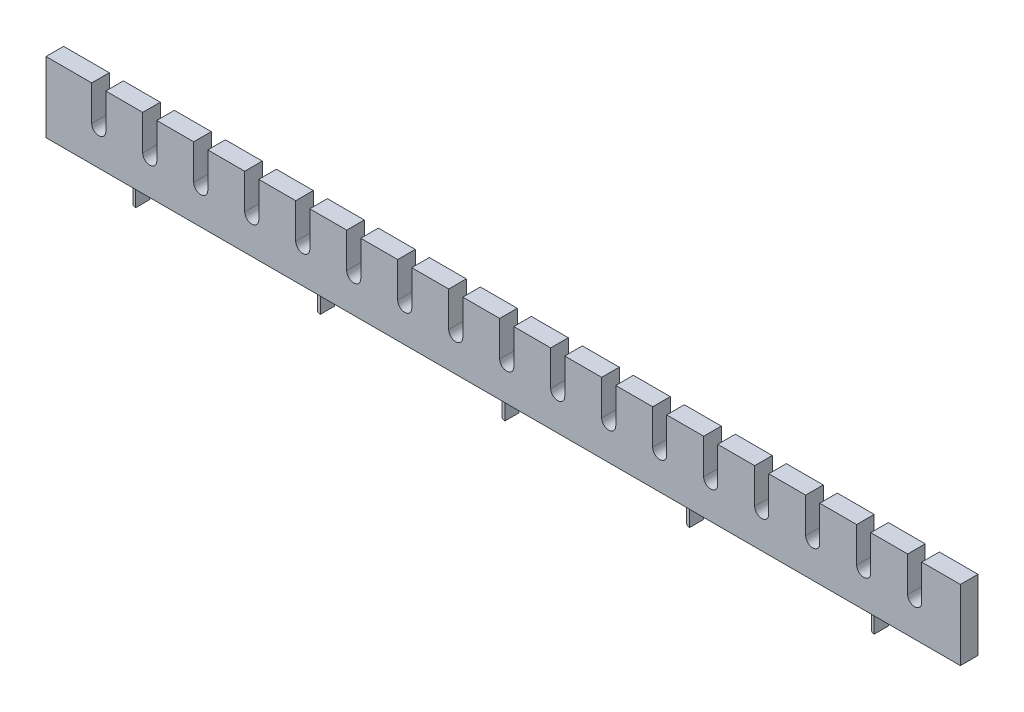
from build123d import *

# Parameters (mm, degrees)
SKETCH1_W           = 330.2
SKETCH1_H           = 6.35
BOSS_EXTRUDE1_DEPTH = 25.4
BOSS_EXTRUDE2_DEPTH = 6.35
CUT_EXTRUDE1_DEPTH  = 168.16307158


with BuildPart() as part:
    # Sketch1 → Boss-Extrude1 (new body)
    with BuildSketch(Plane(origin=(0, 0, 0), x_dir=(1, 0, 0), z_dir=(0, 1, 0))):
        Rectangle(SKETCH1_W, SKETCH1_H)
    extrude(amount=BOSS_EXTRUDE1_DEPTH)

    # Sketch2 → Boss-Extrude2 (add)
    with BuildSketch(Plane.XZ):
        with BuildLine():
            Line((-133.35, 2.54), (-133.35, -2.54))
            ThreePointArc((-133.35, -2.54), (-135.89, 0), (-133.35, 2.54))
        make_face()
        with BuildLine():
            Line((-66.675, 2.54), (-66.675, -2.54))
            ThreePointArc((-66.675, -2.54), (-69.215, 0), (-66.675, 2.54))
        make_face()
        with BuildLine():
            Line((0, 2.54), (0, -2.54))
            ThreePointArc((0, -2.54), (-2.54, 0), (0, 2.54))
        make_face()
        with BuildLine():
            Line((66.675, 2.54), (66.675, -2.54))
            ThreePointArc((66.675, -2.54), (64.135, 0), (66.675, 2.54))
        make_face()
        with BuildLine():
            Line((133.35, 2.54), (133.35, -2.54))
            ThreePointArc((133.35, -2.54), (130.81, 0), (133.35, 2.54))
        make_face()
    extrude(amount=BOSS_EXTRUDE2_DEPTH)

    # Sketch3 → Cut-Extrude1 (cut, through all)
    with BuildSketch(Plane.XY.offset(3.175)):
        with BuildLine():
            Line((-143.51, 38.1), (-143.51, 12.7))
            ThreePointArc((-143.51, 12.7), (-146.05, 10.16), (-148.59, 12.7))
            Line((-148.59, 12.7), (-148.59, 38.1))
            ThreePointArc((-148.59, 38.1), (-146.05, 40.64), (-143.51, 38.1))
        make_face()
        with BuildLine():
            Line((-125.095, 38.1), (-125.095, 12.7))
            ThreePointArc((-125.095, 12.7), (-127.635, 10.16), (-130.175, 12.7))
            Line((-130.175, 12.7), (-130.175, 38.1))
            ThreePointArc((-130.175, 38.1), (-127.635, 40.64), (-125.095, 38.1))
        make_face()
        with BuildLine():
            Line((-106.68, 38.1), (-106.68, 12.7))
            ThreePointArc((-106.68, 12.7), (-109.22, 10.16), (-111.76, 12.7))
            Line((-111.76, 12.7), (-111.76, 38.1))
            ThreePointArc((-111.76, 38.1), (-109.22, 40.64), (-106.68, 38.1))
        make_face()
        with BuildLine():
            Line((-88.265, 38.1), (-88.265, 12.7))
            ThreePointArc((-88.265, 12.7), (-90.805, 10.16), (-93.345, 12.7))
            Line((-93.345, 12.7), (-93.345, 38.1))
            ThreePointArc((-93.345, 38.1), (-90.805, 40.64), (-88.265, 38.1))
        make_face()
        with BuildLine():
            Line((-69.85, 38.1), (-69.85, 12.7))
            ThreePointArc((-69.85, 12.7), (-72.39, 10.16), (-74.93, 12.7))
            Line((-74.93, 12.7), (-74.93, 38.1))
            ThreePointArc((-74.93, 38.1), (-72.39, 40.64), (-69.85, 38.1))
        make_face()
        with BuildLine():
            Line((-51.435, 38.1), (-51.435, 12.7))
            ThreePointArc((-51.435, 12.7), (-53.975, 10.16), (-56.515, 12.7))
            Line((-56.515, 12.7), (-56.515, 38.1))
            ThreePointArc((-56.515, 38.1), (-53.975, 40.64), (-51.435, 38.1))
        make_face()
        with BuildLine():
            Line((-33.02, 38.1), (-33.02, 12.7))
            ThreePointArc((-33.02, 12.7), (-35.56, 10.16), (-38.1, 12.7))
            Line((-38.1, 12.7), (-38.1, 38.1))
            ThreePointArc((-38.1, 38.1), (-35.56, 40.64), (-33.02, 38.1))
        make_face()
        with BuildLine():
            Line((-14.605, 38.1), (-14.605, 12.7))
            ThreePointArc((-14.605, 12.7), (-17.145, 10.16), (-19.685, 12.7))
            Line((-19.685, 12.7), (-19.685, 38.1))
            ThreePointArc((-19.685, 38.1), (-17.145, 40.64), (-14.605, 38.1))
        make_face()
        with BuildLine():
            Line((3.81, 38.1), (3.81, 12.7))
            ThreePointArc((3.81, 12.7), (1.27, 10.16), (-1.27, 12.7))
            Line((-1.27, 12.7), (-1.27, 38.1))
            ThreePointArc((-1.27, 38.1), (1.27, 40.64), (3.81, 38.1))
        make_face()
        with BuildLine():
            Line((22.225, 38.1), (22.225, 12.7))
            ThreePointArc((22.225, 12.7), (19.685, 10.16), (17.145, 12.7))
            Line((17.145, 12.7), (17.145, 38.1))
            ThreePointArc((17.145, 38.1), (19.685, 40.64), (22.225, 38.1))
        make_face()
        with BuildLine():
            Line((40.64, 38.1), (40.64, 12.7))
            ThreePointArc((40.64, 12.7), (38.1, 10.16), (35.56, 12.7))
            Line((35.56, 12.7), (35.56, 38.1))
            ThreePointArc((35.56, 38.1), (38.1, 40.64), (40.64, 38.1))
        make_face()
        with BuildLine():
            Line((59.055, 38.1), (59.055, 12.7))
            ThreePointArc((59.055, 12.7), (56.515, 10.16), (53.975, 12.7))
            Line((53.975, 12.7), (53.975, 38.1))
            ThreePointArc((53.975, 38.1), (56.515, 40.64), (59.055, 38.1))
        make_face()
        with BuildLine():
            Line((77.47, 38.1), (77.47, 12.7))
            ThreePointArc((77.47, 12.7), (74.93, 10.16), (72.39, 12.7))
            Line((72.39, 12.7), (72.39, 38.1))
            ThreePointArc((72.39, 38.1), (74.93, 40.64), (77.47, 38.1))
        make_face()
        with BuildLine():
            Line((95.885, 38.1), (95.885, 12.7))
            ThreePointArc((95.885, 12.7), (93.345, 10.16), (90.805, 12.7))
            Line((90.805, 12.7), (90.805, 38.1))
            ThreePointArc((90.805, 38.1), (93.345, 40.64), (95.885, 38.1))
        make_face()
        with BuildLine():
            Line((114.3, 38.1), (114.3, 12.7))
            ThreePointArc((114.3, 12.7), (111.76, 10.16), (109.22, 12.7))
            Line((109.22, 12.7), (109.22, 38.1))
            ThreePointArc((109.22, 38.1), (111.76, 40.64), (114.3, 38.1))
        make_face()
        with BuildLine():
            Line((132.715, 38.1), (132.715, 12.7))
            ThreePointArc((132.715, 12.7), (130.175, 10.16), (127.635, 12.7))
            Line((127.635, 12.7), (127.635, 38.1))
            ThreePointArc((127.635, 38.1), (130.175, 40.64), (132.715, 38.1))
        make_face()
        with BuildLine():
            Line((151.13, 38.1), (151.13, 12.7))
            ThreePointArc((151.13, 12.7), (148.59, 10.16), (146.05, 12.7))
            Line((146.05, 12.7), (146.05, 38.1))
            ThreePointArc((146.05, 38.1), (148.59, 40.64), (151.13, 38.1))
        make_face()
    extrude(amount=-CUT_EXTRUDE1_DEPTH, mode=Mode.SUBTRACT)


solid = part.part
